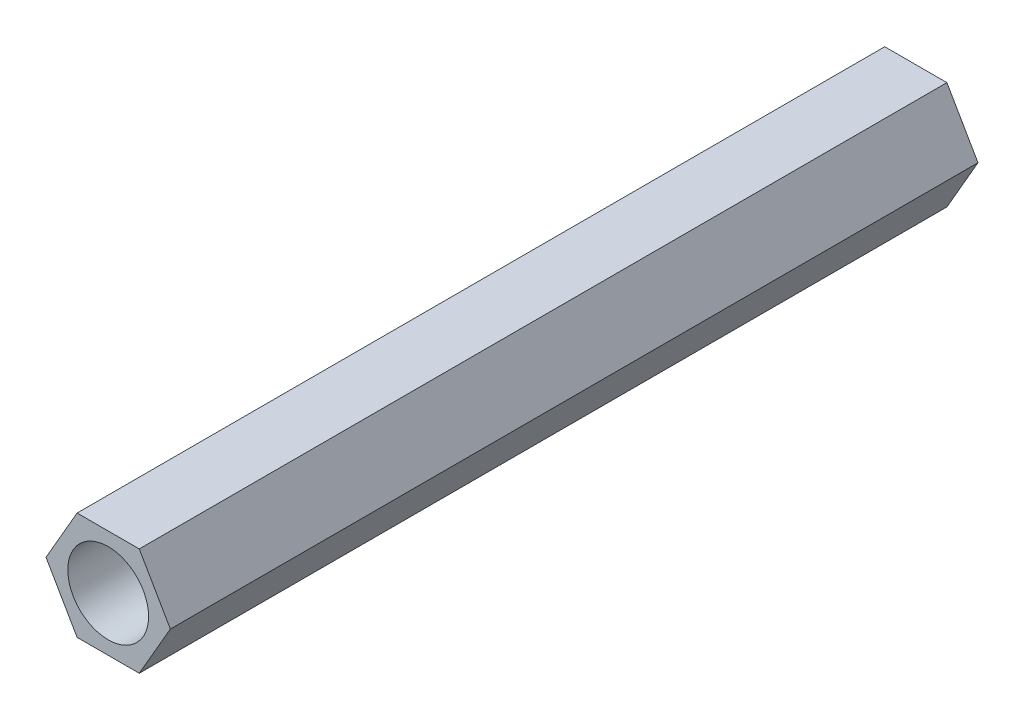
from build123d import *

# Parameters (mm, degrees)
SKETCH_1_R      = 1.5
EXTRUDE_1_DEPTH = 30


with BuildPart() as part:
    # 草图1 → 凸台-拉伸1 (new body)
    with BuildSketch(Plane.XY):
        Polygon((2.309401077, 0), (1.154700538, 2), (-1.154700538, 2), (-2.309401077, 0), (-1.154700538, -2), (1.154700538, -2), align=None)
        Circle(SKETCH_1_R, mode=Mode.SUBTRACT)
    extrude(amount=EXTRUDE_1_DEPTH)


solid = part.part
